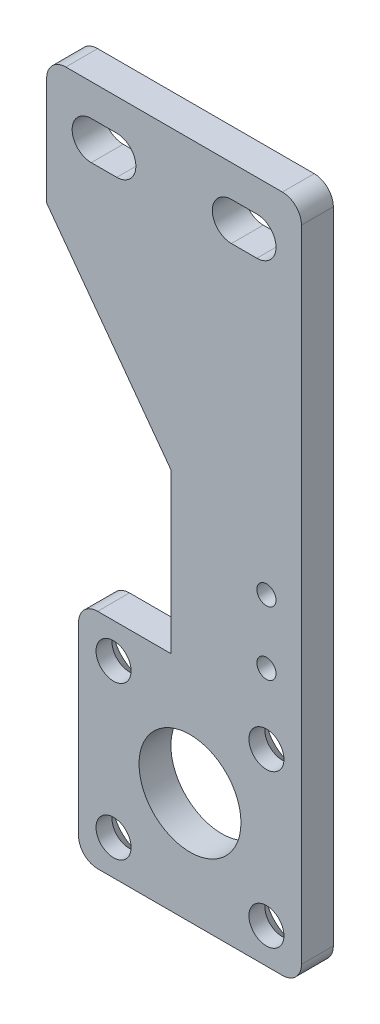
from build123d import *

# Parameters (mm, degrees)
SKETCH_1_R      = 2.75
SKETCH_1_R_2    = 8
SKETCH_1_R_3    = 1.5
EXTRUDE_1_DEPTH = 5
CHAMFER_1_SIZE  = 2.5


with BuildPart() as part:
    # 草图1 → 拉伸1 (new body)
    with BuildSketch(Plane.XY):
        with BuildLine():
            Line((1708.420547593, 1108.565488817), (1708.420547593, 1091.565488817))
            Line((1708.420547593, 1091.565488817), (1727.920547593, 1065.065488817))
            Line((1727.920547593, 1065.065488817), (1727.920547593, 1040.065488817))
            Line((1727.920547593, 1040.065488817), (1716.420547593, 1040.065488817))
            ThreePointArc((1716.420547593, 1040.065488817), (1714.29922725, 1039.186809161), (1713.420547593, 1037.065488817))
            Line((1713.420547593, 1037.065488817), (1713.420547593, 1008.065488817))
            ThreePointArc((1713.420547593, 1008.065488817), (1714.29922725, 1005.944168474), (1716.420547593, 1005.065488817))
            Line((1716.420547593, 1005.065488817), (1745.420547593, 1005.065488817))
            ThreePointArc((1745.420547593, 1005.065488817), (1747.541867937, 1005.944168474), (1748.420547593, 1008.065488817))
            Line((1748.420547593, 1008.065488817), (1748.420547593, 1108.565488817))
            ThreePointArc((1748.420547593, 1108.565488817), (1747.541867937, 1110.686809161), (1745.420547593, 1111.565488817))
            Line((1745.420547593, 1111.565488817), (1711.420547593, 1111.565488817))
            ThreePointArc((1711.420547593, 1111.565488817), (1709.29922725, 1110.686809161), (1708.420547593, 1108.565488817))
        make_face()
        with Locations((1718.920547593, 1010.565488817)):
            Circle(SKETCH_1_R, mode=Mode.SUBTRACT)
        with Locations((1718.920547593, 1034.565488817)):
            Circle(SKETCH_1_R, mode=Mode.SUBTRACT)
        with Locations((1730.920547593, 1022.565488817)):
            Circle(SKETCH_1_R_2, mode=Mode.SUBTRACT)
        with Locations((1742.920547593, 1010.565488817)):
            Circle(SKETCH_1_R, mode=Mode.SUBTRACT)
        with Locations((1742.920547593, 1034.565488817)):
            Circle(SKETCH_1_R, mode=Mode.SUBTRACT)
        with Locations((1742.920547593, 1045.565488817)):
            Circle(SKETCH_1_R_3, mode=Mode.SUBTRACT)
        with Locations((1742.920547593, 1055.565488817)):
            Circle(SKETCH_1_R_3, mode=Mode.SUBTRACT)
        with BuildLine():
            Line((1715.420547593, 1106.565488817), (1719.420547593, 1106.565488817))
            ThreePointArc((1719.420547593, 1106.565488817), (1722.420547593, 1103.565488817), (1719.420547593, 1100.565488817))
            Line((1719.420547593, 1100.565488817), (1715.420547593, 1100.565488817))
            ThreePointArc((1715.420547593, 1100.565488817), (1712.420547593, 1103.565488817), (1715.420547593, 1106.565488817))
        make_face(mode=Mode.SUBTRACT)
        with BuildLine():
            ThreePointArc((1737.420547593, 1100.565488817), (1734.420547593, 1103.565488817), (1737.420547593, 1106.565488817))
            Line((1737.420547593, 1106.565488817), (1741.420547593, 1106.565488817))
            ThreePointArc((1741.420547593, 1106.565488817), (1744.420547593, 1103.565488817), (1741.420547593, 1100.565488817))
            Line((1741.420547593, 1100.565488817), (1737.420547593, 1100.565488817))
        make_face(mode=Mode.SUBTRACT)
    extrude(amount=EXTRUDE_1_DEPTH)

    # 倒角1
    chamfer_1_edges = [part.edges().sort_by_distance(p)[0] for p in [
        (1740.170547593, 1034.565488817, 0),
        (1740.170547593, 1010.565488817, 0),
        (1716.170547593, 1010.565488817, 0),
        (1716.170547593, 1034.565488817, 0),
    ]]
    chamfer(chamfer_1_edges, length=CHAMFER_1_SIZE)


solid = part.part
